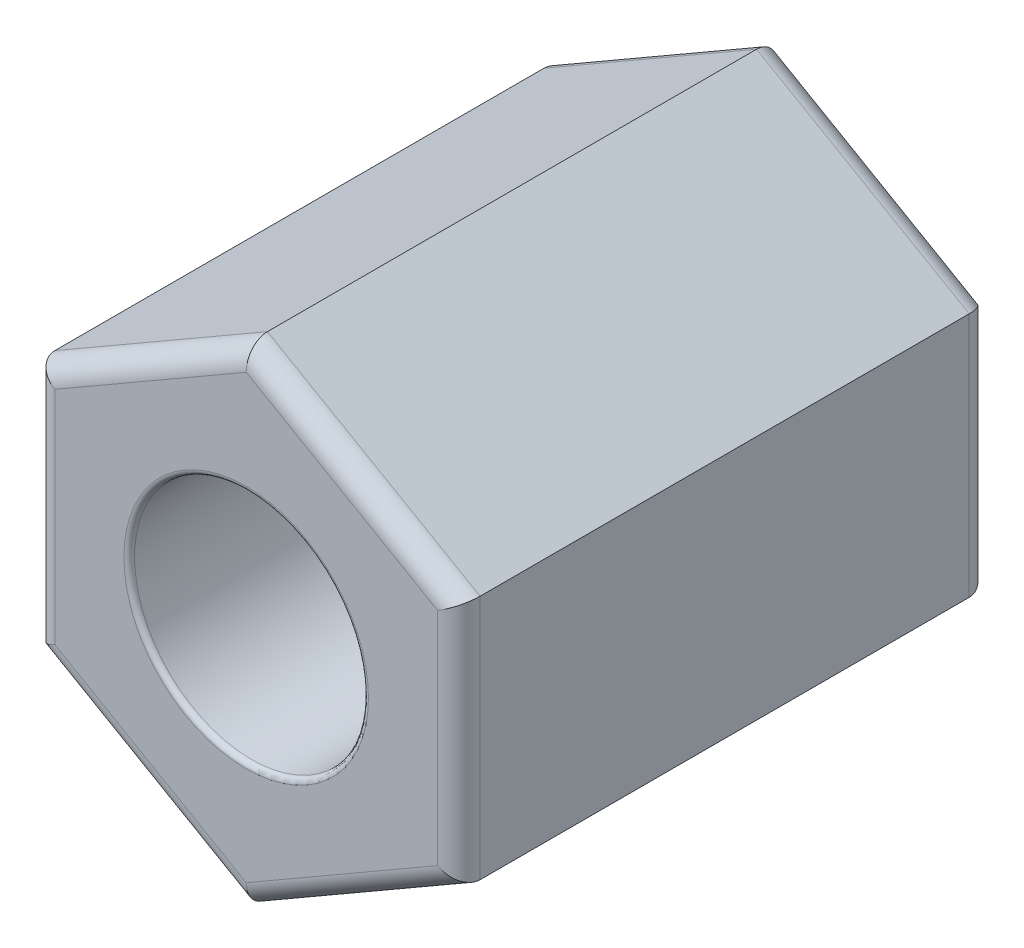
from build123d import *

# Parameters (mm, degrees)
SKETCH_1_R      = 11
EXTRUDE_1_DEPTH = 50
FILLET_1_R      = 2
FILLET_2_R      = 0.5


with BuildPart() as part:
    # 草图1 → 凸台-拉伸1 (new body)
    with BuildSketch(Plane.XY):
        Polygon((0, -23.094010768), (20, -11.547005384), (20, 11.547005384), (0, 23.094010768), (-20, 11.547005384), (-20, -11.547005384), align=None)
        Circle(SKETCH_1_R, mode=Mode.SUBTRACT)
    extrude(amount=EXTRUDE_1_DEPTH)

    # 圆角1
    fillet_1_edges = [part.edges().sort_by_distance(p)[0] for p in [
        (20, 0, 50),
        (10, 17.320508076, 50),
        (-10, 17.320508076, 50),
        (-20, 0, 50),
        (-10, -17.320508076, 50),
        (-20, 0, 0),
        (-10, 17.320508076, 0),
        (10, 17.320508076, 0),
        (10, -17.320508076, 50),
        (20, 0, 0),
        (10, -17.320508076, 0),
        (-10, -17.320508076, 0),
    ]]
    fillet(fillet_1_edges, radius=FILLET_1_R)

    # 圆角2
    fillet_2_edges = [part.edges().sort_by_distance(p)[0] for p in [
        (-11, 0, 0),
        (-11, 0, 50),
    ]]
    fillet(fillet_2_edges, radius=FILLET_2_R)


solid = part.part
